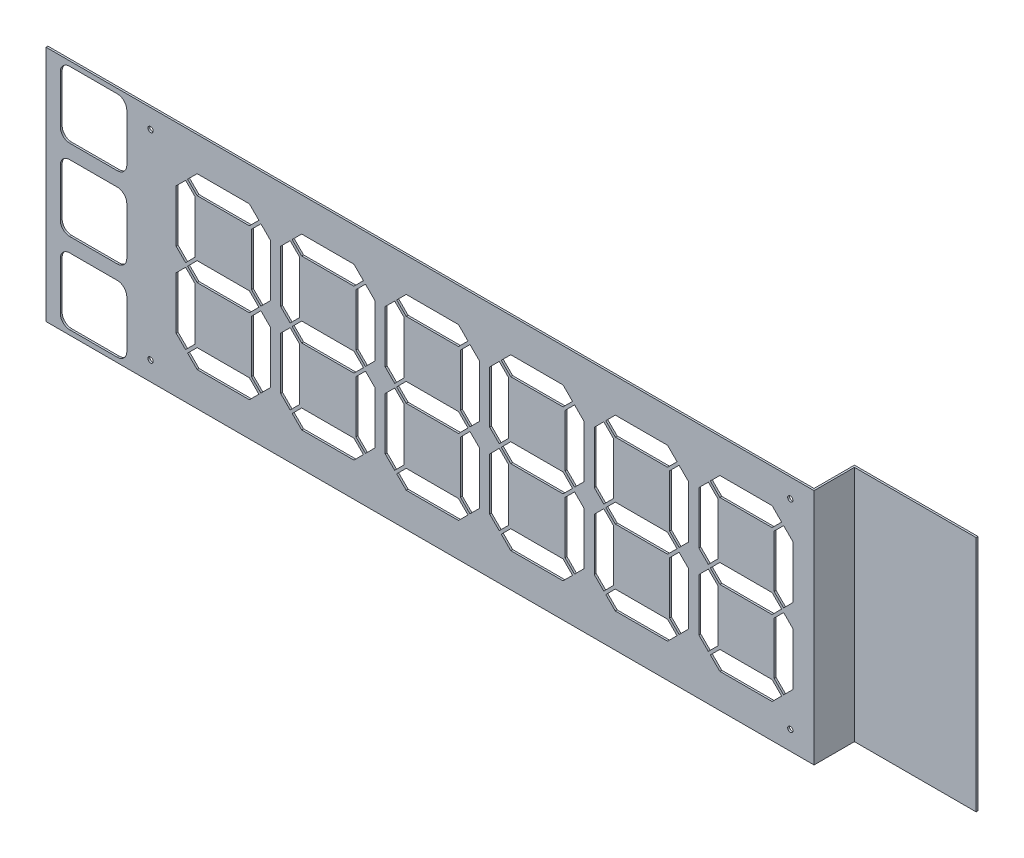
from build123d import *

# Parameters (mm, degrees)
ESQUISSE10_W         = 806.131980515
ESQUISSE10_H         = 250
BOSS_EXTRU_2_DEPTH   = 2
BOSS_EXTRU_3_DEPTH   = 250
D_GAGEMENT_M52_D     = 5.5
D_GAGEMENT_M52_DEPTH = 15
D_GAGEMENT_M52_TIP   = 1.652366702


with BuildPart() as part:
    # Esquisse10 → Boss.-Extru.2 (new body)
    with BuildSketch(Plane.XY):
        with Locations((-263.223527964, 8.537159381)):
            Rectangle(ESQUISSE10_W, ESQUISSE10_H)
        Polygon((107.72114195, -70.705481306), (97.72114195, -60.705481306), (42.72114195, -60.705481306), (32.72114195, -70.705481306), (42.72114195, -80.705481306), (97.72114195, -80.705481306), align=None, mode=Mode.SUBTRACT)
        Polygon((109.842462294, -68.584160963), (119.842462294, -58.584160963), (119.842462294, -3.584160963), (109.842462294, 6.415839037), (99.842462294, -3.584160963), (99.842462294, -58.584160963), align=None, mode=Mode.SUBTRACT)
        Polygon((30.599821607, -68.584160963), (40.599821607, -58.584160963), (40.599821607, -3.584160963), (30.599821607, 6.415839037), (20.599821607, -3.584160963), (20.599821607, -58.584160963), align=None, mode=Mode.SUBTRACT)
        Polygon((107.72114195, 8.537159381), (97.72114195, 18.537159381), (42.72114195, 18.537159381), (32.72114195, 8.537159381), (42.72114195, -1.462840619), (97.72114195, -1.462840619), align=None, mode=Mode.SUBTRACT)
        Polygon((109.842462294, 10.658479725), (119.842462294, 20.658479725), (119.842462294, 75.658479725), (109.842462294, 85.658479725), (99.842462294, 75.658479725), (99.842462294, 20.658479725), align=None, mode=Mode.SUBTRACT)
        Polygon((107.72114195, 87.779800068), (97.72114195, 97.779800068), (42.72114195, 97.779800068), (32.72114195, 87.779800068), (42.72114195, 77.779800068), (97.72114195, 77.779800068), align=None, mode=Mode.SUBTRACT)
        Polygon((30.599821607, 10.658479725), (40.599821607, 20.658479725), (40.599821607, 75.658479725), (30.599821607, 85.658479725), (20.599821607, 75.658479725), (20.599821607, 20.658479725), align=None, mode=Mode.SUBTRACT)
        Polygon((-0.157537706, 10.658479725), (9.842462294, 20.658479725), (9.842462294, 75.658479725), (-0.157537706, 85.658479725), (-10.157537706, 75.658479725), (-10.157537706, 20.658479725), align=None, mode=Mode.SUBTRACT)
        Polygon((-0.157537706, -68.584160963), (9.842462294, -58.584160963), (9.842462294, -3.584160963), (-0.157537706, 6.415839037), (-10.157537706, -3.584160963), (-10.157537706, -58.584160963), align=None, mode=Mode.SUBTRACT)
        Polygon((-2.27885805, -70.705481306), (-12.27885805, -60.705481306), (-67.27885805, -60.705481306), (-77.27885805, -70.705481306), (-67.27885805, -80.705481306), (-12.27885805, -80.705481306), align=None, mode=Mode.SUBTRACT)
        Polygon((-79.400178393, -68.584160963), (-69.400178393, -58.584160963), (-69.400178393, -3.584160963), (-79.400178393, 6.415839037), (-89.400178393, -3.584160963), (-89.400178393, -58.584160963), align=None, mode=Mode.SUBTRACT)
        Polygon((-2.27885805, 8.537159381), (-12.27885805, 18.537159381), (-67.27885805, 18.537159381), (-77.27885805, 8.537159381), (-67.27885805, -1.462840619), (-12.27885805, -1.462840619), align=None, mode=Mode.SUBTRACT)
        Polygon((-79.400178393, 10.658479725), (-69.400178393, 20.658479725), (-69.400178393, 75.658479725), (-79.400178393, 85.658479725), (-89.400178393, 75.658479725), (-89.400178393, 20.658479725), align=None, mode=Mode.SUBTRACT)
        Polygon((-2.27885805, 87.779800068), (-12.27885805, 97.779800068), (-67.27885805, 97.779800068), (-77.27885805, 87.779800068), (-67.27885805, 77.779800068), (-12.27885805, 77.779800068), align=None, mode=Mode.SUBTRACT)
        Polygon((-110.157537706, -68.584160963), (-100.157537706, -58.584160963), (-100.157537706, -3.584160963), (-110.157537706, 6.415839037), (-120.157537706, -3.584160963), (-120.157537706, -58.584160963), align=None, mode=Mode.SUBTRACT)
        Polygon((-112.27885805, -70.705481306), (-122.27885805, -60.705481306), (-177.27885805, -60.705481306), (-187.27885805, -70.705481306), (-177.27885805, -80.705481306), (-122.27885805, -80.705481306), align=None, mode=Mode.SUBTRACT)
        Polygon((-189.400178393, -68.584160963), (-179.400178393, -58.584160963), (-179.400178393, -3.584160963), (-189.400178393, 6.415839037), (-199.400178393, -3.584160963), (-199.400178393, -58.584160963), align=None, mode=Mode.SUBTRACT)
        Polygon((-112.27885805, 8.537159381), (-122.27885805, 18.537159381), (-177.27885805, 18.537159381), (-187.27885805, 8.537159381), (-177.27885805, -1.462840619), (-122.27885805, -1.462840619), align=None, mode=Mode.SUBTRACT)
        Polygon((-110.157537706, 10.658479725), (-100.157537706, 20.658479725), (-100.157537706, 75.658479725), (-110.157537706, 85.658479725), (-120.157537706, 75.658479725), (-120.157537706, 20.658479725), align=None, mode=Mode.SUBTRACT)
        Polygon((-112.27885805, 87.779800068), (-122.27885805, 97.779800068), (-177.27885805, 97.779800068), (-187.27885805, 87.779800068), (-177.27885805, 77.779800068), (-122.27885805, 77.779800068), align=None, mode=Mode.SUBTRACT)
        Polygon((-189.400178393, 10.658479725), (-179.400178393, 20.658479725), (-179.400178393, 75.658479725), (-189.400178393, 85.658479725), (-199.400178393, 75.658479725), (-199.400178393, 20.658479725), align=None, mode=Mode.SUBTRACT)
        Polygon((-222.27885805, -70.705481306), (-232.27885805, -60.705481306), (-287.27885805, -60.705481306), (-297.27885805, -70.705481306), (-287.27885805, -80.705481306), (-232.27885805, -80.705481306), align=None, mode=Mode.SUBTRACT)
        Polygon((-220.157537706, -68.584160963), (-210.157537706, -58.584160963), (-210.157537706, -3.584160963), (-220.157537706, 6.415839037), (-230.157537706, -3.584160963), (-230.157537706, -58.584160963), align=None, mode=Mode.SUBTRACT)
        Polygon((-299.400178393, -68.584160963), (-289.400178393, -58.584160963), (-289.400178393, -3.584160963), (-299.400178393, 6.415839037), (-309.400178393, -3.584160963), (-309.400178393, -58.584160963), align=None, mode=Mode.SUBTRACT)
        Polygon((-222.27885805, 8.537159381), (-232.27885805, 18.537159381), (-287.27885805, 18.537159381), (-297.27885805, 8.537159381), (-287.27885805, -1.462840619), (-232.27885805, -1.462840619), align=None, mode=Mode.SUBTRACT)
        Polygon((-220.157537706, 10.658479725), (-210.157537706, 20.658479725), (-210.157537706, 75.658479725), (-220.157537706, 85.658479725), (-230.157537706, 75.658479725), (-230.157537706, 20.658479725), align=None, mode=Mode.SUBTRACT)
        Polygon((-299.400178393, 10.658479725), (-289.400178393, 20.658479725), (-289.400178393, 75.658479725), (-299.400178393, 85.658479725), (-309.400178393, 75.658479725), (-309.400178393, 20.658479725), align=None, mode=Mode.SUBTRACT)
        Polygon((-222.27885805, 87.779800068), (-232.27885805, 97.779800068), (-287.27885805, 97.779800068), (-297.27885805, 87.779800068), (-287.27885805, 77.779800068), (-232.27885805, 77.779800068), align=None, mode=Mode.SUBTRACT)
        Polygon((-332.27885805, -70.705481306), (-342.27885805, -60.705481306), (-397.27885805, -60.705481306), (-407.27885805, -70.705481306), (-397.27885805, -80.705481306), (-342.27885805, -80.705481306), align=None, mode=Mode.SUBTRACT)
        Polygon((-330.157537706, -68.584160963), (-320.157537706, -58.584160963), (-320.157537706, -3.584160963), (-330.157537706, 6.415839037), (-340.157537706, -3.584160963), (-340.157537706, -58.584160963), align=None, mode=Mode.SUBTRACT)
        Polygon((-409.400178393, -68.584160963), (-399.400178393, -58.584160963), (-399.400178393, -3.584160963), (-409.400178393, 6.415839037), (-419.400178393, -3.584160963), (-419.400178393, -58.584160963), align=None, mode=Mode.SUBTRACT)
        Polygon((-332.27885805, 8.537159381), (-342.27885805, 18.537159381), (-397.27885805, 18.537159381), (-407.27885805, 8.537159381), (-397.27885805, -1.462840619), (-342.27885805, -1.462840619), align=None, mode=Mode.SUBTRACT)
        Polygon((-330.157537706, 10.658479725), (-320.157537706, 20.658479725), (-320.157537706, 75.658479725), (-330.157537706, 85.658479725), (-340.157537706, 75.658479725), (-340.157537706, 20.658479725), align=None, mode=Mode.SUBTRACT)
        Polygon((-332.27885805, 87.779800068), (-342.27885805, 97.779800068), (-397.27885805, 97.779800068), (-407.27885805, 87.779800068), (-397.27885805, 77.779800068), (-342.27885805, 77.779800068), align=None, mode=Mode.SUBTRACT)
        Polygon((-409.400178393, 10.658479725), (-399.400178393, 20.658479725), (-399.400178393, 75.658479725), (-409.400178393, 85.658479725), (-419.400178393, 75.658479725), (-419.400178393, 20.658479725), align=None, mode=Mode.SUBTRACT)
        Polygon((-440.157537706, -68.584160963), (-430.157537706, -58.584160963), (-430.157537706, -3.584160963), (-440.157537706, 6.415839037), (-450.157537706, -3.584160963), (-450.157537706, -58.584160963), align=None, mode=Mode.SUBTRACT)
        Polygon((-442.27885805, -70.705481306), (-452.27885805, -60.705481306), (-507.27885805, -60.705481306), (-517.27885805, -70.705481306), (-507.27885805, -80.705481306), (-452.27885805, -80.705481306), align=None, mode=Mode.SUBTRACT)
        Polygon((-519.400178393, -68.584160963), (-509.400178393, -58.584160963), (-509.400178393, -3.584160963), (-519.400178393, 6.415839037), (-529.400178393, -3.584160963), (-529.400178393, -58.584160963), align=None, mode=Mode.SUBTRACT)
        Polygon((-442.27885805, 8.537159381), (-452.27885805, 18.537159381), (-507.27885805, 18.537159381), (-517.27885805, 8.537159381), (-507.27885805, -1.462840619), (-452.27885805, -1.462840619), align=None, mode=Mode.SUBTRACT)
        Polygon((-440.157537706, 10.658479725), (-430.157537706, 20.658479725), (-430.157537706, 75.658479725), (-440.157537706, 85.658479725), (-450.157537706, 75.658479725), (-450.157537706, 20.658479725), align=None, mode=Mode.SUBTRACT)
        Polygon((-519.400178393, 10.658479725), (-509.400178393, 20.658479725), (-509.400178393, 75.658479725), (-519.400178393, 85.658479725), (-529.400178393, 75.658479725), (-529.400178393, 20.658479725), align=None, mode=Mode.SUBTRACT)
        Polygon((-442.27885805, 87.779800068), (-452.27885805, 97.779800068), (-507.27885805, 97.779800068), (-517.27885805, 87.779800068), (-507.27885805, 77.779800068), (-452.27885805, 77.779800068), align=None, mode=Mode.SUBTRACT)
        with BuildLine():
            Line((-591.289518221, -111.462840619), (-641.289518221, -111.462840619))
            ThreePointArc((-641.289518221, -111.462840619), (-648.360586033, -108.533908431), (-651.289518221, -101.462840619))
            Line((-651.289518221, -101.462840619), (-651.289518221, -51.462840619))
            ThreePointArc((-651.289518221, -51.462840619), (-648.360586033, -44.391772807), (-641.289518221, -41.462840619))
            Line((-641.289518221, -41.462840619), (-591.289518221, -41.462840619))
            ThreePointArc((-591.289518221, -41.462840619), (-584.21845041, -44.391772807), (-581.289518221, -51.462840619))
            Line((-581.289518221, -51.462840619), (-581.289518221, -101.462840619))
            ThreePointArc((-581.289518221, -101.462840619), (-584.21845041, -108.533908431), (-591.289518221, -111.462840619))
        make_face(mode=Mode.SUBTRACT)
        with BuildLine():
            Line((-651.289518221, -16.462840619), (-651.289518221, 33.537159381))
            ThreePointArc((-651.289518221, 33.537159381), (-648.360586033, 40.608227193), (-641.289518221, 43.537159381))
            Line((-641.289518221, 43.537159381), (-591.289518221, 43.537159381))
            ThreePointArc((-591.289518221, 43.537159381), (-584.21845041, 40.608227193), (-581.289518221, 33.537159381))
            Line((-581.289518221, 33.537159381), (-581.289518221, -16.462840619))
            ThreePointArc((-581.289518221, -16.462840619), (-584.21845041, -23.533908431), (-591.289518221, -26.462840619))
            Line((-591.289518221, -26.462840619), (-641.289518221, -26.462840619))
            ThreePointArc((-641.289518221, -26.462840619), (-648.360586033, -23.533908431), (-651.289518221, -16.462840619))
        make_face(mode=Mode.SUBTRACT)
        with BuildLine():
            Line((-641.289518221, 128.537159381), (-591.289518221, 128.537159381))
            ThreePointArc((-591.289518221, 128.537159381), (-584.21845041, 125.608227193), (-581.289518221, 118.537159381))
            Line((-581.289518221, 118.537159381), (-581.289518221, 68.537159381))
            ThreePointArc((-581.289518221, 68.537159381), (-584.21845041, 61.466091569), (-591.289518221, 58.537159381))
            Line((-591.289518221, 58.537159381), (-641.289518221, 58.537159381))
            ThreePointArc((-641.289518221, 58.537159381), (-648.360586033, 61.466091569), (-651.289518221, 68.537159381))
            Line((-651.289518221, 68.537159381), (-651.289518221, 118.537159381))
            ThreePointArc((-651.289518221, 118.537159381), (-648.360586033, 125.608227193), (-641.289518221, 128.537159381))
        make_face(mode=Mode.SUBTRACT)
    extrude(amount=BOSS_EXTRU_2_DEPTH)

    # Esquisse11 → Boss.-Extru.3 (add)
    with BuildSketch(Plane.XZ.offset(116.462840619)):
        Polygon((139.842462294, 2), (141.842462294, 2), (141.842462294, -40.5), (269.842462294, -40.5), (269.842462294, -42.5), (139.842462294, -42.5), (139.842462294, -35.5), align=None)
    extrude(amount=-BOSS_EXTRU_3_DEPTH)

    # Dégagement M52
    with Locations(Plane(origin=(-556.289518221, 113.537159381, 2), x_dir=(1, 0, 0), z_dir=(0, 0, 1))):
        with Locations((0, 0), (0, -210), (673.131980515, 0), (673.131980515, -210)):
            Hole(D_GAGEMENT_M52_D / 2, depth=D_GAGEMENT_M52_DEPTH)
            with Locations((0, 0, -(D_GAGEMENT_M52_DEPTH + D_GAGEMENT_M52_TIP / 2))):  # 118° drill point
                Cone(0, D_GAGEMENT_M52_D / 2, D_GAGEMENT_M52_TIP, mode=Mode.SUBTRACT)


solid = part.part
